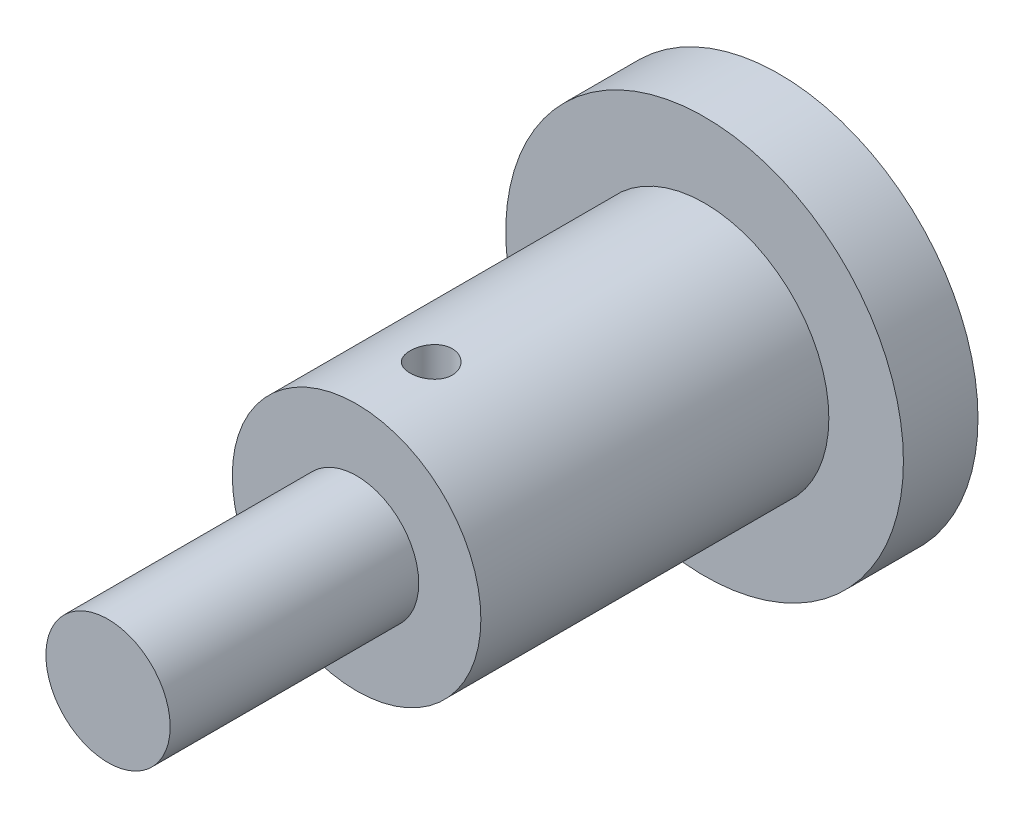
from build123d import *

# Parameters (mm, degrees)
SKETCH1_R           = 8
BOSS_EXTRUDE1_DEPTH = 3
SKETCH2_R           = 5
BOSS_EXTRUDE2_DEPTH = 14
SKETCH3_R           = 2.5
BOSS_EXTRUDE3_DEPTH = 10
SKETCH4_R           = 0.85
CUT_EXTRUDE1_DEPTH  = 7.5


with BuildPart() as part:
    # Sketch1 → Boss-Extrude1 (new body)
    with BuildSketch(Plane.XY):
        Circle(SKETCH1_R)
    extrude(amount=BOSS_EXTRUDE1_DEPTH)

    # Sketch2 → Boss-Extrude2 (add)
    with BuildSketch(Plane.XY.offset(3)):
        Circle(SKETCH2_R)
    extrude(amount=BOSS_EXTRUDE2_DEPTH)

    # Sketch3 → Boss-Extrude3 (add)
    with BuildSketch(Plane.XY.offset(17)):
        Circle(SKETCH3_R)
    extrude(amount=BOSS_EXTRUDE3_DEPTH)

    # Sketch4 → Cut-Extrude1 (cut, symmetric)
    with BuildSketch(Plane(origin=(0, 0, 0), x_dir=(1, 0, 0), z_dir=(0, 1, 0))):
        with Locations(Location((0, -14, 0), (0, 0, 270))):
            Circle(SKETCH4_R)
    extrude(amount=CUT_EXTRUDE1_DEPTH, both=True, mode=Mode.SUBTRACT)


solid = part.part
